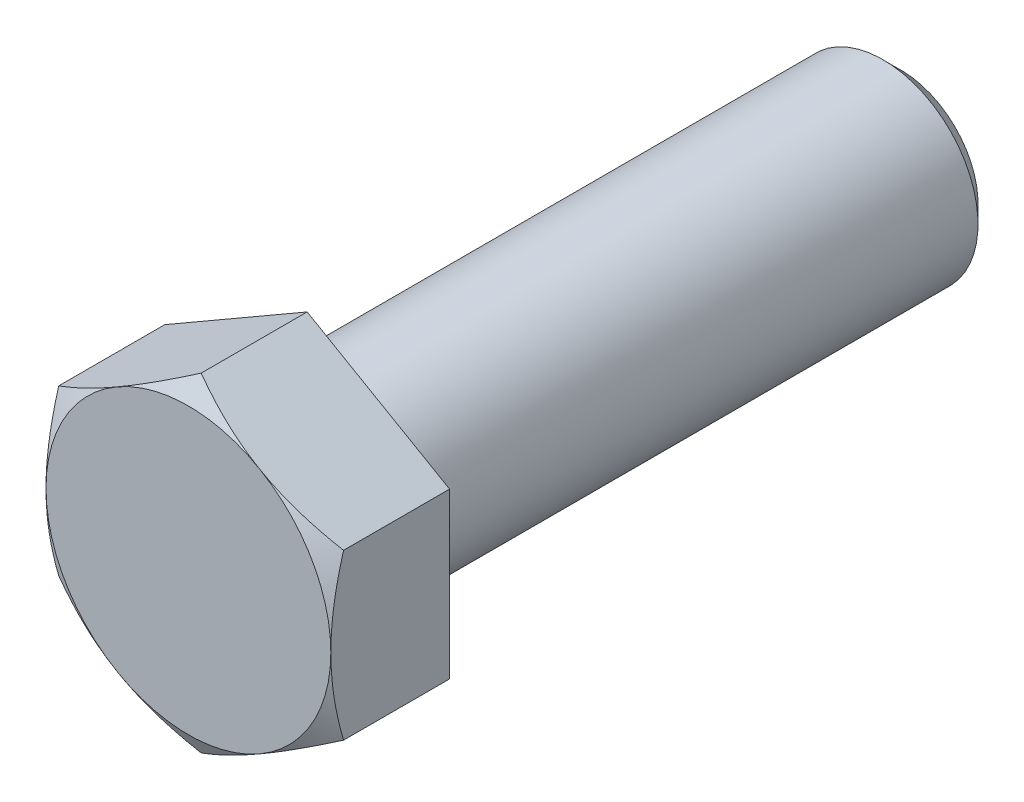
from build123d import *

# Parameters (mm, degrees)
EXTRUDE_378_DEPTH   = 10
SKETCH_2_OUTSIDE_W  = 172.148
SKETCH_2_OUTSIDE_H  = 175.86
SKETCH_2_OUTSIDE_R  = 11.994451842
CUT_EXTRUDE_1_DEPTH = 40
CUT_EXTRUDE_1_DRAFT = -60
SKETCH_3_R          = 8
EXTRUDE_1_DEPTH     = 50
CHAMFER_1_SIZE      = 1.5
FILLET_1_R          = 1


with BuildPart() as part:
    # Эскиз1 → Extrude 378 (new body)
    with BuildSketch(Plane.XY):
        Polygon((-11.994451842, 6.925), (0, 13.85), (11.994451842, 6.925), (11.994451842, -6.925), (0, -13.85), (-11.994451842, -6.925), align=None)
    extrude(amount=EXTRUDE_378_DEPTH)


with BuildPart() as cut_extrude_1_tool:
    # Эскиз2 outside → Вырез-Вытянуть1 (with draft: the straight prism first)
    with BuildSketch(Plane.XY.offset(10)):
        Rectangle(SKETCH_2_OUTSIDE_W, SKETCH_2_OUTSIDE_H)
        Circle(SKETCH_2_OUTSIDE_R, mode=Mode.SUBTRACT)
    extrude(amount=-CUT_EXTRUDE_1_DEPTH)
    # Вырез-Вытянуть1: the draft: its side faces are tilted about the plane it starts from
    cut_extrude_1_sides = [cut_extrude_1_tool.faces().sort_by_distance(p)[0] for p in [
        (0, -87.93, -10),
        (86.074, 0, -10),
        (0, 87.93, -10),
        (-86.074, 0, -10),
        (-11.994451842, 0, -10),
    ]]
    draft(cut_extrude_1_sides, Plane.XY.offset(10), CUT_EXTRUDE_1_DRAFT)


with BuildPart() as part_1:
    add(part.part)

    # Вырез-Вытянуть1: cut by cut_extrude_1_tool
    add(cut_extrude_1_tool.part, mode=Mode.SUBTRACT)

    # Эскиз3 → Бобышка-Вытянуть1 (add)
    with BuildSketch(Plane(origin=(0, 0, 0), x_dir=(-1, 0, 0), z_dir=(0, 0, -1))):
        Circle(SKETCH_3_R)
    extrude(amount=EXTRUDE_1_DEPTH)

    # Фаска1
    chamfer_1_edges = [part_1.edges().sort_by_distance(p)[0] for p in [
        (8, 0, -50),
    ]]
    chamfer(chamfer_1_edges, length=CHAMFER_1_SIZE)

    # Скругление1
    fillet_1_edges = [part_1.edges().sort_by_distance(p)[0] for p in [
        (8, 0, 0),
    ]]
    fillet(fillet_1_edges, radius=FILLET_1_R)


solid = part_1.part
